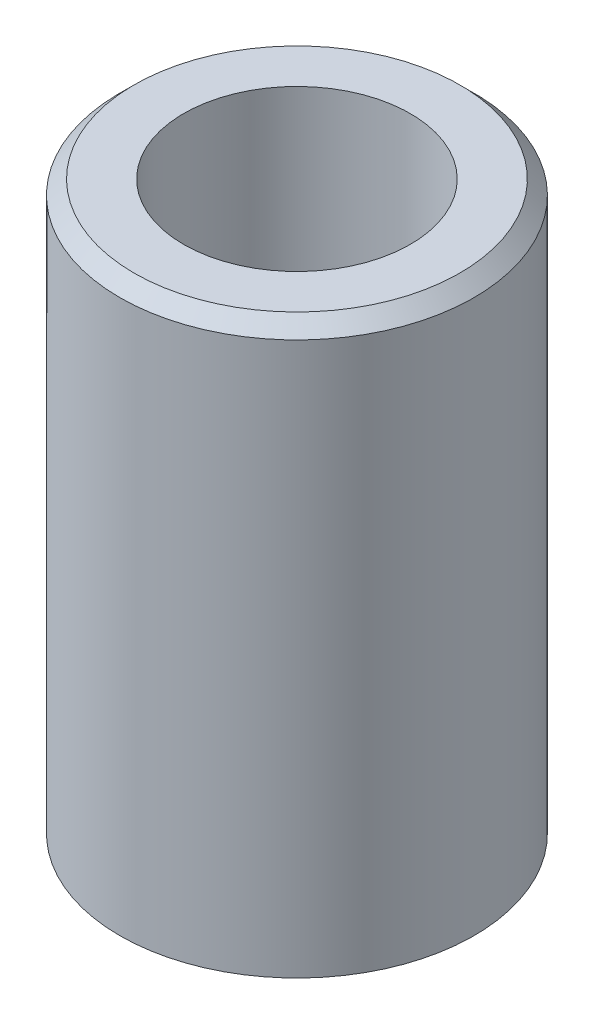
from build123d import *

# Parameters (mm, degrees)
SKETCH1_R           = 2.5
SKETCH1_R_2         = 1.6
BOSS_EXTRUDE1_DEPTH = 8
CHAMFER1_SIZE       = 0.2


with BuildPart() as part:
    # Sketch1 → Boss-Extrude1 (new body)
    with BuildSketch(Plane(origin=(0, 0, 0), x_dir=(1, 0, 0), z_dir=(0, 1, 0))):
        with Locations(Location((0, 0, 0), (0, 0, 270))):
            Circle(SKETCH1_R)
        with Locations(Location((0, 0, 0), (0, 0, 270))):
            Circle(SKETCH1_R_2, mode=Mode.SUBTRACT)
    extrude(amount=BOSS_EXTRUDE1_DEPTH)

    # Chamfer1
    chamfer1_edges = [part.edges().sort_by_distance(p)[0] for p in [
        (0, 8, -2.5),
    ]]
    chamfer(chamfer1_edges, length=CHAMFER1_SIZE)


solid = part.part
